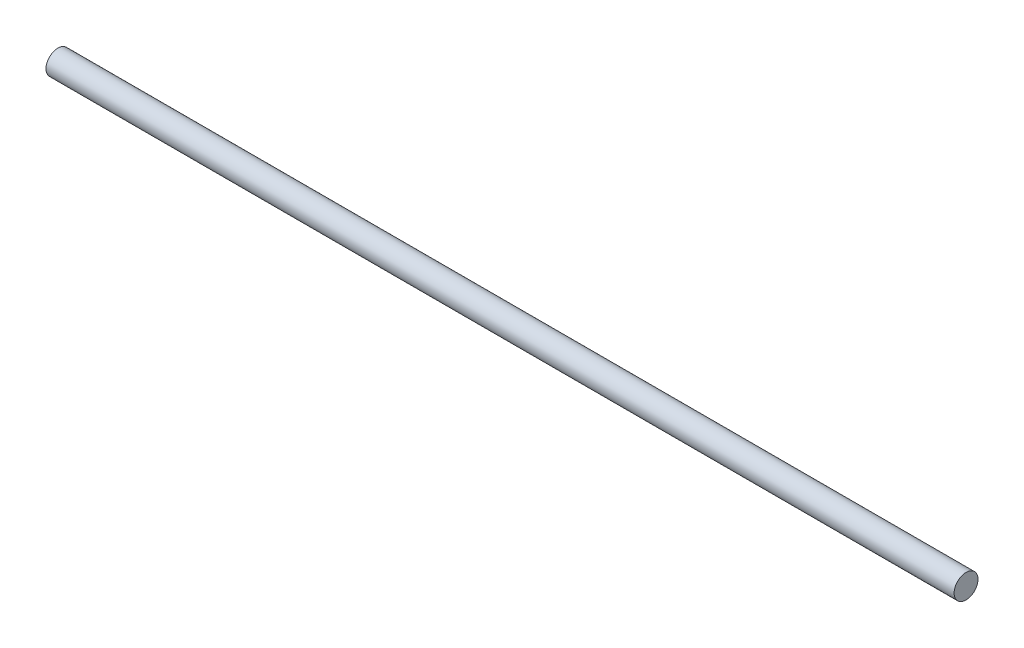
from build123d import *

# Parameters (mm, degrees)
SKETCH1_R           = 4
BOSS_EXTRUDE1_DEPTH = 152


with BuildPart() as part:
    # Sketch1 → Boss-Extrude1 (new, symmetric)
    with BuildSketch(Plane(origin=(0, 0, 0), x_dir=(0, 0, -1), z_dir=(1, 0, 0))):
        Circle(SKETCH1_R)
    extrude(amount=BOSS_EXTRUDE1_DEPTH, both=True)


solid = part.part
